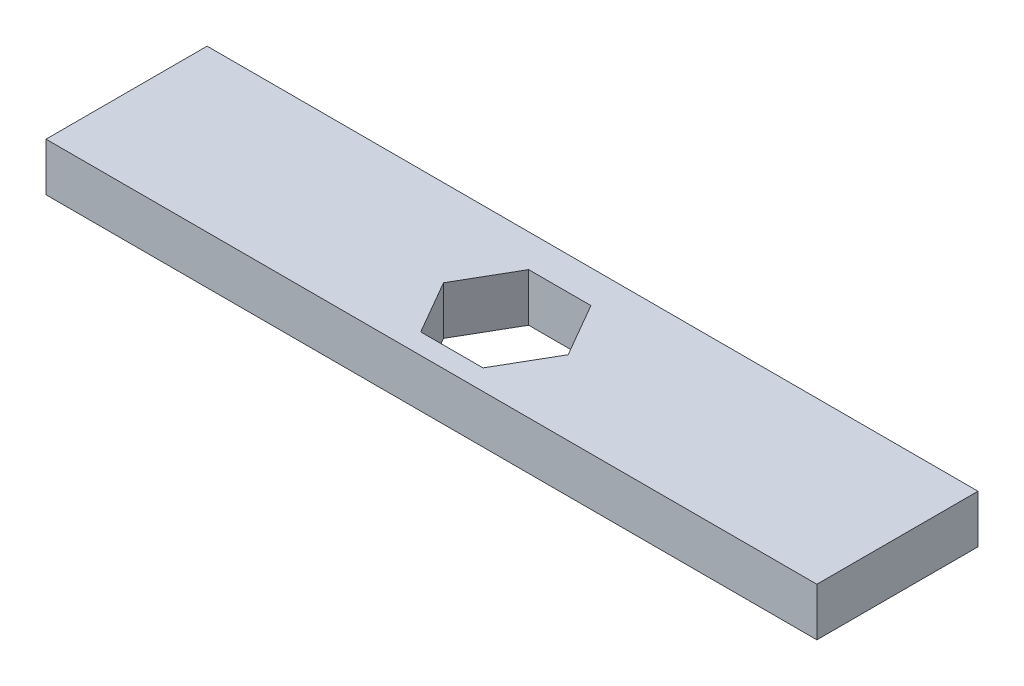
from build123d import *

# Parameters (mm, degrees)
SKIZZE1_W                       = 40
SKIZZE1_H                       = 8.36
AUFSATZ_LINEAR_AUSTRAGEN1_DEPTH = 2.5
SCHNITT_LINEAR_AUSTRAGEN1_DEPTH = 2.5


with BuildPart() as part:
    # Skizze1 → Aufsatz-Linear austragen1 (new body)
    with BuildSketch(Plane(origin=(0, 0, 0), x_dir=(1, 0, 0), z_dir=(0, 1, 0))):
        with Locations((20, 4.18)):
            Rectangle(SKIZZE1_W, SKIZZE1_H)
    extrude(amount=AUFSATZ_LINEAR_AUSTRAGEN1_DEPTH)

    # Skizze3 → Schnitt-Linear austragen1 (cut)
    with BuildSketch(Plane(origin=(0, 2.5, 0), x_dir=(1, 0, 0), z_dir=(0, 1, 0))):
        Polygon((23.233161507, 3.86), (21.616580754, 6.66), (18.383419246, 6.66), (16.766838493, 3.86), (18.383419246, 1.06), (21.616580754, 1.06), align=None)
    extrude(amount=-SCHNITT_LINEAR_AUSTRAGEN1_DEPTH, mode=Mode.SUBTRACT)


solid = part.part
